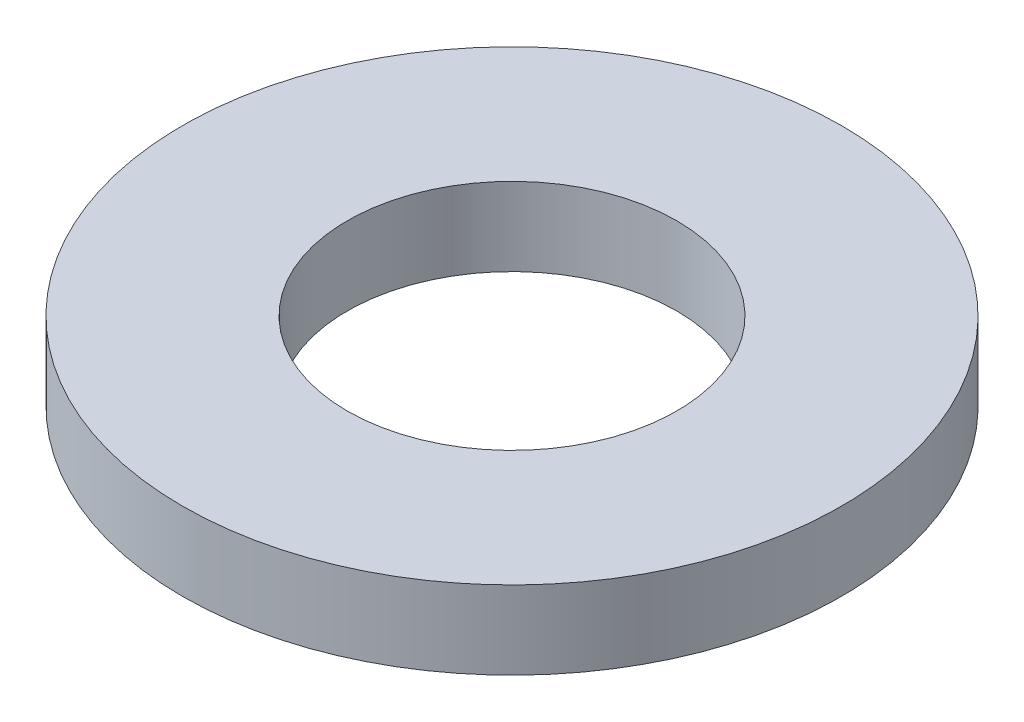
from build123d import *

# Parameters (mm, degrees)
SKETCH1_R           = 3.9624
BOSS_EXTRUDE1_DEPTH = 0.9398
SKETCH5_R           = 1.9812
CUT_EXTRUDE1_DEPTH  = 6.681940827


with BuildPart() as part:
    # Sketch1 → Boss-Extrude1 (new body)
    with BuildSketch(Plane(origin=(0, 0, 0), x_dir=(1, 0, 0), z_dir=(0, 1, 0))):
        with Locations(Location((0, 0, 0), (0, 0, 270))):
            Circle(SKETCH1_R)
    extrude(amount=BOSS_EXTRUDE1_DEPTH)

    # Sketch5 → Cut-Extrude1 (cut, through all)
    with BuildSketch(Plane(origin=(0, 0.9398, 0), x_dir=(-1, 0, 0), z_dir=(0, 1, 0))):
        with Locations(Location((0, 0, 0), (0, 0, 90))):
            Circle(SKETCH5_R)
    extrude(amount=-CUT_EXTRUDE1_DEPTH, mode=Mode.SUBTRACT)


solid = part.part
